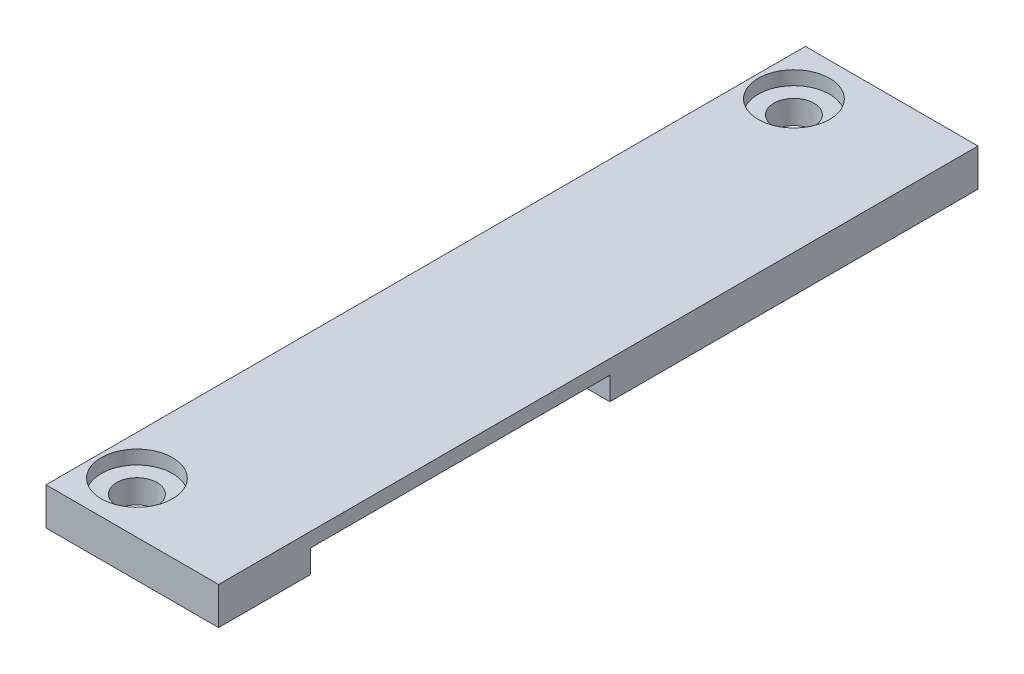
from build123d import *

# Parameters (mm, degrees)
EXTRUDE_1_DEPTH     = 15
SKETCH_2_R          = 1.75
CUT_EXTRUDE_1_DEPTH = 37.394539426
SKETCH_2_3_R        = 3.1
SKETCH_2_3_R_2      = 1.75
CUT_EXTRUDE_2_DEPTH = 1.2


with BuildPart() as part:
    # 草图1 → 凸台-拉伸1 (new body)
    with BuildSketch(Plane(origin=(0, 0, 0), x_dir=(0, 0, -1), z_dir=(1, 0, 0))):
        Polygon((33, 1.625), (-33, 1.625), (-33, -1.625), (-25, -1.625), (-25, 0.375), (1, 0.375), (1, -1.625), (33, -1.625), align=None)
    extrude(amount=EXTRUDE_1_DEPTH)

    # 草图2 → 切除-拉伸1 (cut, through all)
    with BuildSketch(Plane(origin=(0, 1.625, 0), x_dir=(1, 0, 0), z_dir=(0, 1, 0))):
        with Locations((3.451122219, 28.55)):
            Circle(SKETCH_2_R)
        with Locations((3.451122219, -28.55)):
            Circle(SKETCH_2_R)
    extrude(amount=-CUT_EXTRUDE_1_DEPTH, mode=Mode.SUBTRACT)

    # 草图2<3> → 切除-拉伸2 (cut)
    # profile 1 of 2: a face of its own
    with BuildSketch(Plane(origin=(0, 1.625, 0), x_dir=(1, 0, 0), z_dir=(0, 1, 0))):
        with Locations((3.451122219, 28.55)):
            Circle(SKETCH_2_3_R)
        with Locations((3.451122219, 28.55)):
            Circle(SKETCH_2_3_R_2, mode=Mode.SUBTRACT)
    # profile 2 of 2: a face of its own
    with BuildSketch(Plane(origin=(0, 1.625, 0), x_dir=(1, 0, 0), z_dir=(0, 1, 0))):
        with Locations((3.451122219, -28.55)):
            Circle(SKETCH_2_3_R)
        with Locations((3.451122219, -28.55)):
            Circle(SKETCH_2_3_R_2, mode=Mode.SUBTRACT)
    extrude(amount=-CUT_EXTRUDE_2_DEPTH, mode=Mode.SUBTRACT)


solid = part.part
